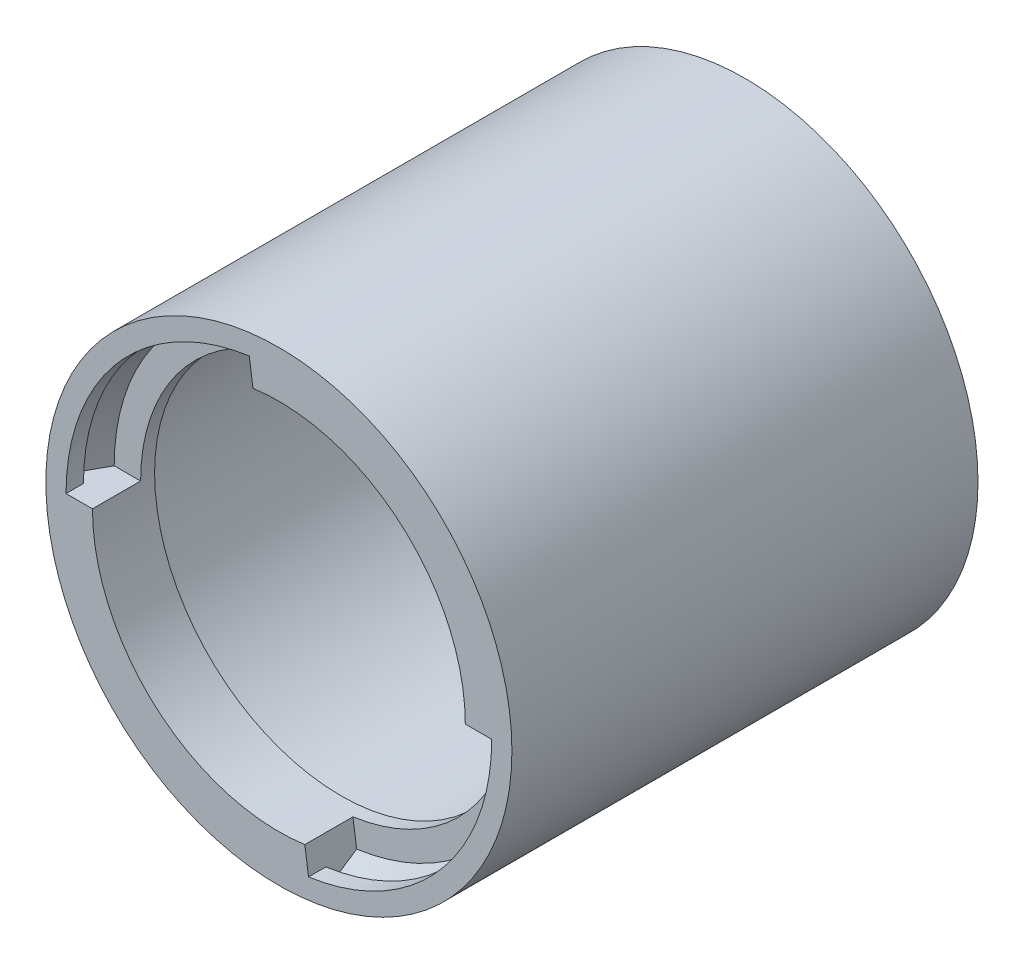
from build123d import *

# Parameters (mm, degrees)
IZIM1_R                     = 15
IZIM1_R_2                   = 13.5
Y_KSEKLIK_EKSTR_ZYON1_DEPTH = 30
Y_KSEKLIK_EKSTR_ZYON2_START = -4
IZIM3_R                     = 13.5
IZIM3_R_2                   = 12
Y_KSEKLIK_EKSTR_ZYON2_DEPTH = 4


with BuildPart() as part:
    # Çizim1 → Yükseklik-Ekstrüzyon1 (new body)
    with BuildSketch(Plane.XY):
        Circle(IZIM1_R)
        Circle(IZIM1_R_2, mode=Mode.SUBTRACT)
    extrude(amount=Y_KSEKLIK_EKSTR_ZYON1_DEPTH)

    # Çizim3 → Yükseklik-Ekstrüzyon2 (add)
    with BuildSketch(Plane.XY.offset(30).offset(Y_KSEKLIK_EKSTR_ZYON2_START)):
        Circle(IZIM3_R)
        Circle(IZIM3_R_2, mode=Mode.SUBTRACT)
    extrude(amount=Y_KSEKLIK_EKSTR_ZYON2_DEPTH)

    # Kes-Süpür2: sweep along a path in Çizim5
    with BuildLine(Plane.XY.offset(30)) as kes_s_p_r2_path:
        ThreePointArc((-1.906671483, 13.566672542), (-10.339521249, 8.988008697), (-13.7, 0))
    # Çizim4 → Kes-Süpür2 (sweep, cut)
    with BuildSketch(Plane(origin=(0, 0, 0), x_dir=(1, 0, 0), z_dir=(0, 1, 0))):
        Polygon((-13.7, -30), (-13.7, -28.88), (-14.43, -28.23), (-13.7, -26.9), (-11.7, -26.9), (-11.7, -30), align=None)
    kes_s_p_r2 = sweep(path=kes_s_p_r2_path.line, mode=Mode.SUBTRACT)

    # Aynalama2: Kes-Süpür2 across plane
    add(kes_s_p_r2.mirror(Plane(origin=(0, 0, 0), x_dir=(0, 0, 1), z_dir=(0.7547095802227689, -0.6560590289905109, 0))), mode=Mode.SUBTRACT)


solid = part.part
